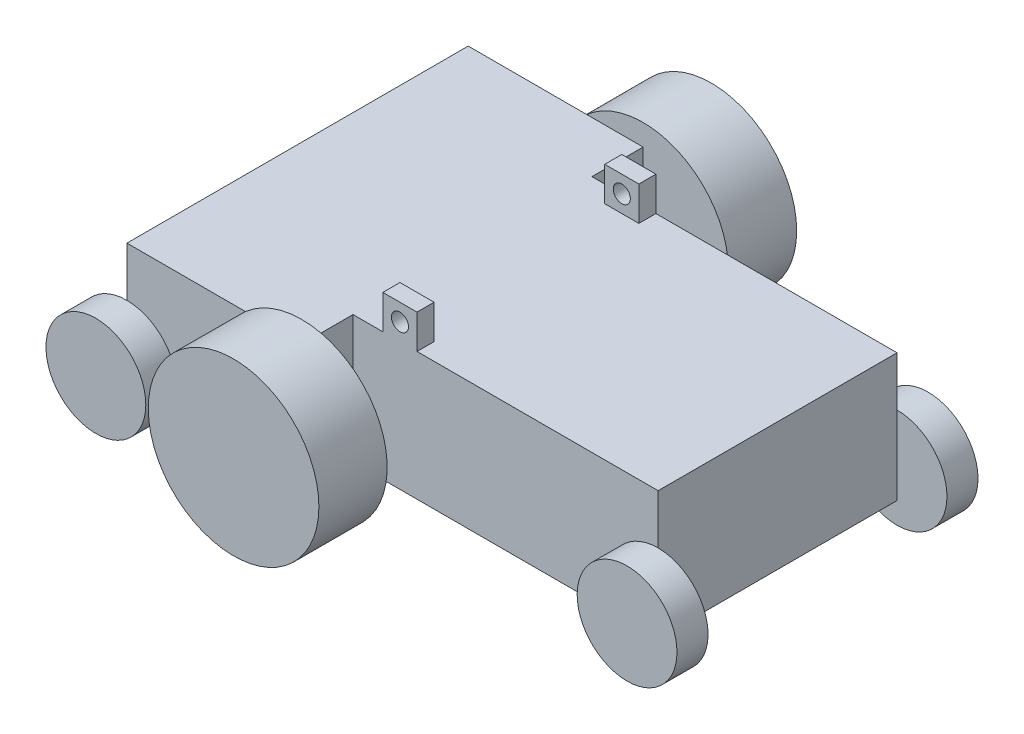
from build123d import *

# Parameters (mm, degrees)
BOSS_EXTRUDE1_DEPTH = 190.5
SKETCH2_R           = 127
BOSS_EXTRUDE2_DEPTH = 101.6
SKETCH3_R           = 74.295
BOSS_EXTRUDE3_DEPTH = 46.228
SKETCH4_R           = 74.295
BOSS_EXTRUDE4_DEPTH = 46.228
SKETCH6_W           = 25.4
SKETCH6_H           = 50.8
BOSS_EXTRUDE5_DEPTH = 25.4
SKETCH7_R           = 12.7
CUT_EXTRUDE1_DEPTH  = 73.152


with BuildPart() as part:
    # Sketch1 → Boss-Extrude1 (new body)
    with BuildSketch(Plane(origin=(0, 0, 0), x_dir=(1, 0, 0), z_dir=(0, 1, 0))):
        Polygon((260.35, 508), (260.35, 431.8), (714.502, 431.8), (714.502, 76.2), (260.35, 76.2), (260.35, 0), (0, 0), (0, 508), align=None)
    extrude(amount=BOSS_EXTRUDE1_DEPTH)

    # Sketch2 → Boss-Extrude2 (add)
    with BuildSketch(Plane.XY):
        with Locations(Location((260.35, 95.25, 0), (0, 0, 228.590377891))):
            Circle(SKETCH2_R)
    boss_extrude2 = extrude(amount=BOSS_EXTRUDE2_DEPTH)

    # Sketch3 → Boss-Extrude3 (add)
    with BuildSketch(Plane.XY):
        with Locations(Location((0, 42.418, 0), (0, 0, 90))):
            Circle(SKETCH3_R)
    boss_extrude3 = extrude(amount=BOSS_EXTRUDE3_DEPTH)

    # Sketch4 → Boss-Extrude4 (add)
    with BuildSketch(Plane.XY.offset(-76.2)):
        with Locations(Location((714.502, 42.418, 0), (0, 0, 214.815812785))):
            Circle(SKETCH4_R)
    boss_extrude4 = extrude(amount=BOSS_EXTRUDE4_DEPTH)

    # Mirror1: Boss-Extrude2, Boss-Extrude3, Boss-Extrude4 across plane
    add(boss_extrude2.mirror(Plane.XY.offset(-254)))
    add(boss_extrude3.mirror(Plane.XY.offset(-254)))
    add(boss_extrude4.mirror(Plane.XY.offset(-254)))

    # Sketch6 → Boss-Extrude5 (add, symmetric)
    with BuildSketch(Plane.ZY.offset(-330.2)):
        with Locations((-88.9, 215.9)):
            Rectangle(SKETCH6_W, SKETCH6_H)
    boss_extrude5 = extrude(amount=BOSS_EXTRUDE5_DEPTH, both=True)

    # Sketch7 → Cut-Extrude1 (cut)
    with BuildSketch(Plane(origin=(0, 0, -101.6), x_dir=(-1, 0, 0), z_dir=(0, 0, -1))):
        with Locations((-330.2, 215.9)):
            Circle(SKETCH7_R)
    cut_extrude1 = extrude(amount=-CUT_EXTRUDE1_DEPTH, mode=Mode.SUBTRACT)

    # Mirror2: Boss-Extrude5, Cut-Extrude1 across plane
    add(boss_extrude5.mirror(Plane.XY.offset(-254)))
    add(cut_extrude1.mirror(Plane.XY.offset(-254)), mode=Mode.SUBTRACT)


solid = part.part
